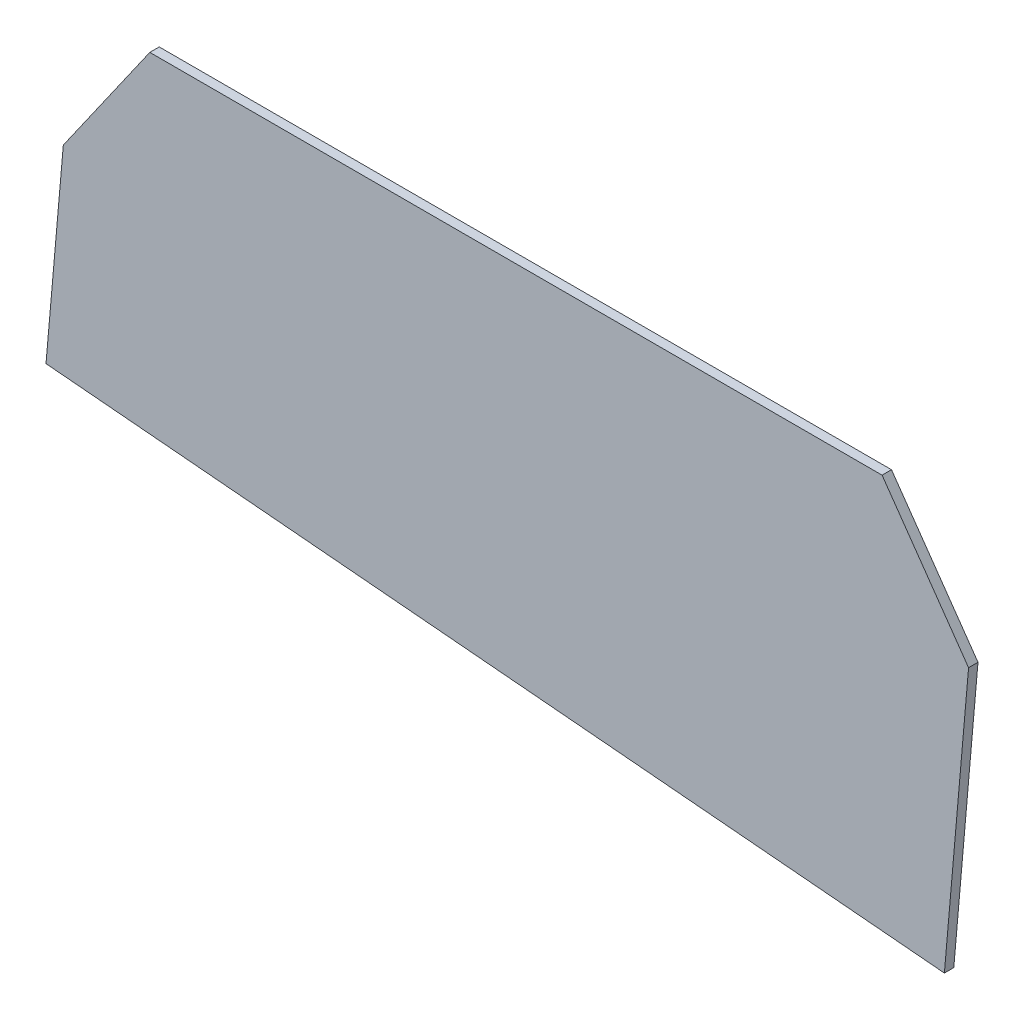
from build123d import *

# Parameters (mm, degrees)
BOSS_EXTRUDE1_DEPTH = 3.175


with BuildPart() as part:
    # Sketch1 → Boss-Extrude1 (new body)
    with BuildSketch(Plane.XY):
        Polygon((-79.850081257, 25.4), (-50.712398291, -16.21292385), (-58.863628504, -109.381911523), (-361.522202615, -82.90271737), (-355.687601709, -16.21292385), (-326.549918742, 25.4), align=None)
    extrude(amount=BOSS_EXTRUDE1_DEPTH)


solid = part.part
